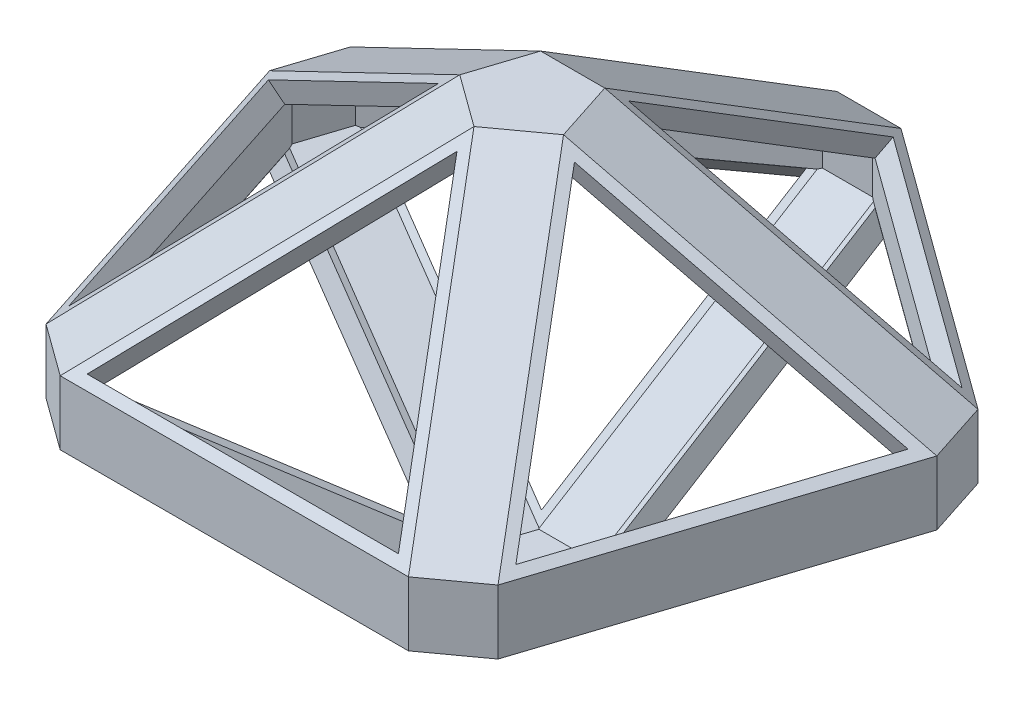
from build123d import *

# Parameters (mm, degrees)
EXTRUDE_1_DEPTH          = 6
EXTRUDE_2_DEPTH          = 50
EXTRUDE_3_REACH          = 116.36
EXTRUDE_4_REACH          = 109.318
PATTERN_CIRCULAR_1_COUNT = 5
CUT_EXTRUDE_START        = 34.260416
CUT_EXTRUDE_2_DEPTH      = 15.739584
SHELL_2_T                = 4
CUT_EXTRUDE_3_DEPTH      = 4
PATTERN_CIRCULAR_2_COUNT = 5
MIRROR_2_COPY_1_DEPTH    = 4
MIRROR_2_COPY_2_DEPTH    = 4
MIRROR_2_COPY_3_DEPTH    = 4
MIRROR_2_COPY_4_DEPTH    = 4


with BuildPart() as part:
    # 草图1 → 凸台-拉伸1 (new body)
    with BuildSketch(Plane(origin=(0, 0, 0), x_dir=(1, 0, 0), z_dir=(0, 1, 0))):
        Polygon((6, 63.6928095), (-6, 63.6928095), (-58.72135955, 25.388499653), (-62.429563482, 13.975821457), (-42.291796068, -48.001853791), (-32.583592135, -55.055276819), (32.583592135, -55.055276819), (42.291796068, -48.001853791), (62.429563482, 13.975821457), (58.72135955, 25.388499653), align=None)
    extrude(amount=EXTRUDE_1_DEPTH)

    # 草图2 → 凸台-拉伸2 (add)
    with BuildSketch(Plane(origin=(0, 6, 0), x_dir=(1, 0, 0), z_dir=(0, 1, 0))):
        Polygon((-6, 8.258291523), (-9.708203932, -3.154386673), (0, -10.2078097), (9.708203932, -3.154386673), (6, 8.258291523), align=None)
    extrude(amount=EXTRUDE_2_DEPTH)

    # 草图3 → 凸台-拉伸3 (add, up to next)
    with BuildSketch(Plane(origin=(22.048945114, 30.347769421, 7.164136549), x_dir=(-0.8164965809277247, 0.5619055660577269, 0.1326479105251229), z_dir=(-0.5773502691896276, -0.7946544722917646, -0.18759247408508062)), mode=Mode.PRIVATE) as extrude_3_sk1:
        Polygon((-49.45595525, 14.980471634), (-24.792327887, -45.339238172), (15.114259472, 6.179944577), align=None)
    extrude_3_tool1 = extrude(extrude_3_sk1.sketch, amount=EXTRUDE_3_REACH, mode=Mode.PRIVATE) - part.part
    extrude_3 = extrude_3_tool1.solids().sort_by_distance((38.143188, 17.420139, 12.393473))[0]
    add(extrude_3)

    # 草图5 → 凸台-拉伸4 (add, up to next)
    with BuildSketch(Plane(origin=(19.294598211, 32.825931131, -6.26919499), x_dir=(0.8660254037844378, -0.49112347318842436, 0.09379623704254153), z_dir=(0.5000000000000017, 0.8506508083520388, -0.16245984811645525)), mode=Mode.PRIVATE) as extrude_4_sk1:
        Polygon((-11.069414635, -10.650937771), (49.807967622, 12.602153105), (45.526102544, 23.812221413), (-15.351279712, 0.559130537), align=None)
    extrude_4_tool1 = extrude(extrude_4_sk1.sketch, amount=-EXTRUDE_4_REACH, mode=Mode.PRIVATE) - part.part
    extrude_4 = extrude_4_tool1.solids().sort_by_distance((34.214782, 23.130208, -11.117056))[0]
    add(extrude_4)

    # 阵列(圆周)1: 凸台-拉伸3, 凸台-拉伸4 ×5 about axis
    pattern_circular_1_axis = Axis((0, 0, 0), (0, 1, 0))
    add([extrude_3.rotate(pattern_circular_1_axis, i * 360 / PATTERN_CIRCULAR_1_COUNT) for i in range(1, PATTERN_CIRCULAR_1_COUNT)])
    add([extrude_4.rotate(pattern_circular_1_axis, i * 360 / PATTERN_CIRCULAR_1_COUNT) for i in range(1, PATTERN_CIRCULAR_1_COUNT)])

    # 草图2<2> → 切除-拉伸2 (cut)
    with BuildSketch(Plane(origin=(0, 6, 0), x_dir=(1, 0, 0), z_dir=(0, 1, 0)).offset(CUT_EXTRUDE_START)):
        Polygon((-6, 8.258291523), (-9.708203932, -3.154386673), (0, -10.2078097), (9.708203932, -3.154386673), (6, 8.258291523), align=None)
    extrude(amount=CUT_EXTRUDE_2_DEPTH, mode=Mode.SUBTRACT)

    # 镜向1: part across plane


with BuildPart() as part_1:
    add(part.part)
    add(part.part.mirror(Plane.ZX))

    # 抽壳2 (no face opened: a closed hollow body)
    add(offset(amount=-SHELL_2_T, mode=Mode.PRIVATE), mode=Mode.SUBTRACT)

    # 草图6 → 切除-拉伸3 (cut)
    with BuildSketch(Plane(origin=(22.048945114, 30.347769421, 7.164136549), x_dir=(0.8164965809277248, -0.5619055660577268, -0.13264791052512276), z_dir=(0.5773502691896275, 0.7946544722917647, 0.18759247408508056))):
        Polygon((-11.411800298, 4.66607666), (24.252146374, -41.375880513), (46.29367759, 12.530981891), align=None)
    cut_extrude_3 = extrude(amount=-CUT_EXTRUDE_3_DEPTH, mode=Mode.SUBTRACT)

    # 阵列(圆周)2: 切除-拉伸3 ×5 about axis
    pattern_circular_2_axis = Axis((0, 0, 0), (0, 1, 0))
    for i in range(1, PATTERN_CIRCULAR_2_COUNT):
        add(cut_extrude_3.rotate(pattern_circular_2_axis, i * 360 / PATTERN_CIRCULAR_2_COUNT), mode=Mode.SUBTRACT)

    # 镜向2: 切除-拉伸3 across plane
    add(cut_extrude_3.mirror(Plane.ZX), mode=Mode.SUBTRACT)

    # 镜向2 copy 1 sketch → 镜向2 copy 1 (cut)
    with BuildSketch(Plane(origin=(13.626997497, -30.347769421, -18.755952985), x_dir=(0.12615565967785208, 0.5619055660577268, -0.8175248524446163), z_dir=(0.3568220897730911, -0.7946544722917647, -0.4911234731884244))):
        Polygon((-11.411800298, -4.66607666), (24.252146374, 41.375880513), (46.29367759, -12.530981891), align=None)
    extrude(amount=-MIRROR_2_COPY_1_DEPTH, mode=Mode.SUBTRACT)

    # 镜向2 copy 2 sketch → 镜向2 copy 2 (cut)
    with BuildSketch(Plane(origin=(-13.626997497, -30.347769421, -18.755952985), x_dir=(-0.7385280953736475, 0.5619055660577268, -0.37261023493339274), z_dir=(-0.3568220897730909, -0.7946544722917647, -0.49112347318842464))):
        Polygon((-11.411800298, -4.66607666), (24.252146374, 41.375880513), (46.29367759, -12.530981891), align=None)
    extrude(amount=-MIRROR_2_COPY_2_DEPTH, mode=Mode.SUBTRACT)

    # 镜向2 copy 3 sketch → 镜向2 copy 3 (cut)
    with BuildSketch(Plane(origin=(-22.048945114, -30.347769421, 7.164136549), x_dir=(-0.5825911242654904, 0.5619055660577267, 0.5872390626996962), z_dir=(-0.5773502691896276, -0.7946544722917646, 0.18759247408508029))):
        Polygon((-11.411800298, -4.66607666), (24.252146374, 41.375880513), (46.29367759, -12.530981891), align=None)
    extrude(amount=-MIRROR_2_COPY_3_DEPTH, mode=Mode.SUBTRACT)

    # 镜向2 copy 4 sketch → 镜向2 copy 4 (cut)
    with BuildSketch(Plane(origin=(0, -30.347769421, 23.183632872), x_dir=(0.37846697903356086, 0.5619055660577268, 0.7355439352034356), z_dir=(0, -0.7946544722917647, 0.6070619982066882))):
        Polygon((-11.411800298, -4.66607666), (24.252146374, 41.375880513), (46.29367759, -12.530981891), align=None)
    extrude(amount=-MIRROR_2_COPY_4_DEPTH, mode=Mode.SUBTRACT)


solid = part_1.part
